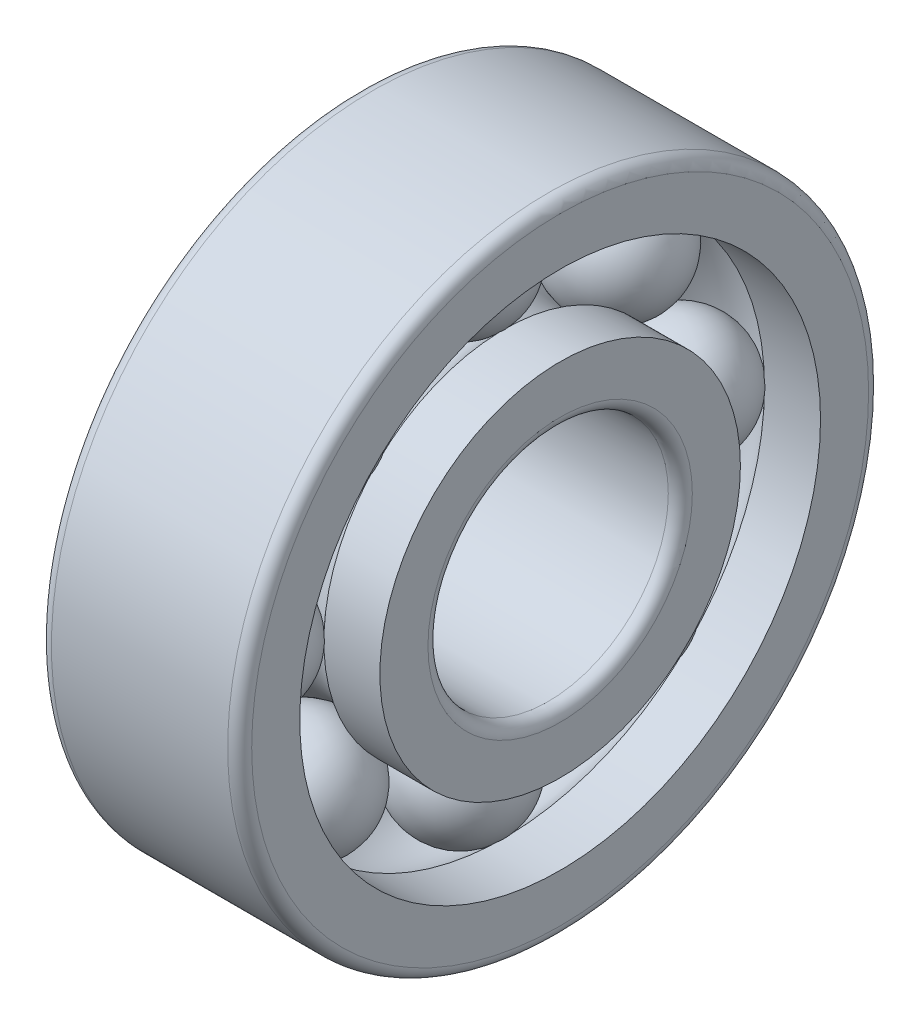
from build123d import *

# Parameters (mm, degrees)
R_P_TITION_CIRCULAIRE1_COUNT = 8


with BuildPart() as part:
    # BalDetSke → BallDetailed (revolve)
    with BuildSketch(Plane.XY):
        with BuildLine():
            Line((-3, 11), (3, 11))
            ThreePointArc((3, 11), (0, 8), (-3, 11))
        make_face()
    revolve(axis=Axis((-1.905, 11, 0), (1, 0, 0)))


with BuildPart() as body_2:
    # InnRacSke → InnerRace (revolve)
    with BuildSketch(Plane.XY):
        with BuildLine():
            Line((-2.202413449, 9), (-5, 9))
            Line((-5, 9), (-5, 6.6))
            ThreePointArc((-5, 6.6), (-4.824264069, 6.175735931), (-4.4, 6))
            Line((-4.4, 6), (4.4, 6))
            ThreePointArc((4.4, 6), (4.824264069, 6.175735931), (5, 6.6))
            Line((5, 6.6), (5, 9))
            Line((5, 9), (2.202413449, 9))
            ThreePointArc((2.202413449, 9), (0, 8.025), (-2.202413449, 9))
        make_face()
    revolve(axis=Axis((-20.6375, 0, 0), (1, 0, 0)))


with BuildPart() as body_3:
    # OutRacSke → OuterRace (revolve)
    with BuildSketch(Plane.XY):
        with BuildLine():
            Line((-2.202413449, 13), (-5, 13))
            Line((-5, 13), (-5, 15.4))
            ThreePointArc((-5, 15.4), (-4.824264069, 15.824264069), (-4.4, 16))
            Line((-4.4, 16), (4.4, 16))
            ThreePointArc((4.4, 16), (4.824264069, 15.824264069), (5, 15.4))
            Line((5, 15.4), (5, 13))
            Line((5, 13), (2.202413449, 13))
            ThreePointArc((2.202413449, 13), (0, 13.975), (-2.202413449, 13))
        make_face()
    revolve(axis=Axis((-20.6375, 0, 0), (1, 0, 0)))


with BuildPart() as r_p_tition_circulaire1_1:
    # Répétition circulaire1: pattern copy
    add(part.part.rotate(Axis((-20.6375, 0, 0), (1, 0, 0)), 1 * 360 / R_P_TITION_CIRCULAIRE1_COUNT))


with BuildPart() as r_p_tition_circulaire1_2:
    # Répétition circulaire1: pattern copy
    add(part.part.rotate(Axis((-20.6375, 0, 0), (1, 0, 0)), 2 * 360 / R_P_TITION_CIRCULAIRE1_COUNT))


with BuildPart() as r_p_tition_circulaire1_3:
    # Répétition circulaire1: pattern copy
    add(part.part.rotate(Axis((-20.6375, 0, 0), (1, 0, 0)), 3 * 360 / R_P_TITION_CIRCULAIRE1_COUNT))


with BuildPart() as r_p_tition_circulaire1_4:
    # Répétition circulaire1: pattern copy
    add(part.part.rotate(Axis((-20.6375, 0, 0), (1, 0, 0)), 4 * 360 / R_P_TITION_CIRCULAIRE1_COUNT))


with BuildPart() as r_p_tition_circulaire1_5:
    # Répétition circulaire1: pattern copy
    add(part.part.rotate(Axis((-20.6375, 0, 0), (1, 0, 0)), 5 * 360 / R_P_TITION_CIRCULAIRE1_COUNT))


with BuildPart() as r_p_tition_circulaire1_6:
    # Répétition circulaire1: pattern copy
    add(part.part.rotate(Axis((-20.6375, 0, 0), (1, 0, 0)), 6 * 360 / R_P_TITION_CIRCULAIRE1_COUNT))


with BuildPart() as r_p_tition_circulaire1_7:
    # Répétition circulaire1: pattern copy
    add(part.part.rotate(Axis((-20.6375, 0, 0), (1, 0, 0)), 7 * 360 / R_P_TITION_CIRCULAIRE1_COUNT))


solid = Compound([part.part, body_2.part, body_3.part, r_p_tition_circulaire1_1.part, r_p_tition_circulaire1_2.part, r_p_tition_circulaire1_3.part, r_p_tition_circulaire1_4.part, r_p_tition_circulaire1_5.part, r_p_tition_circulaire1_6.part, r_p_tition_circulaire1_7.part])
